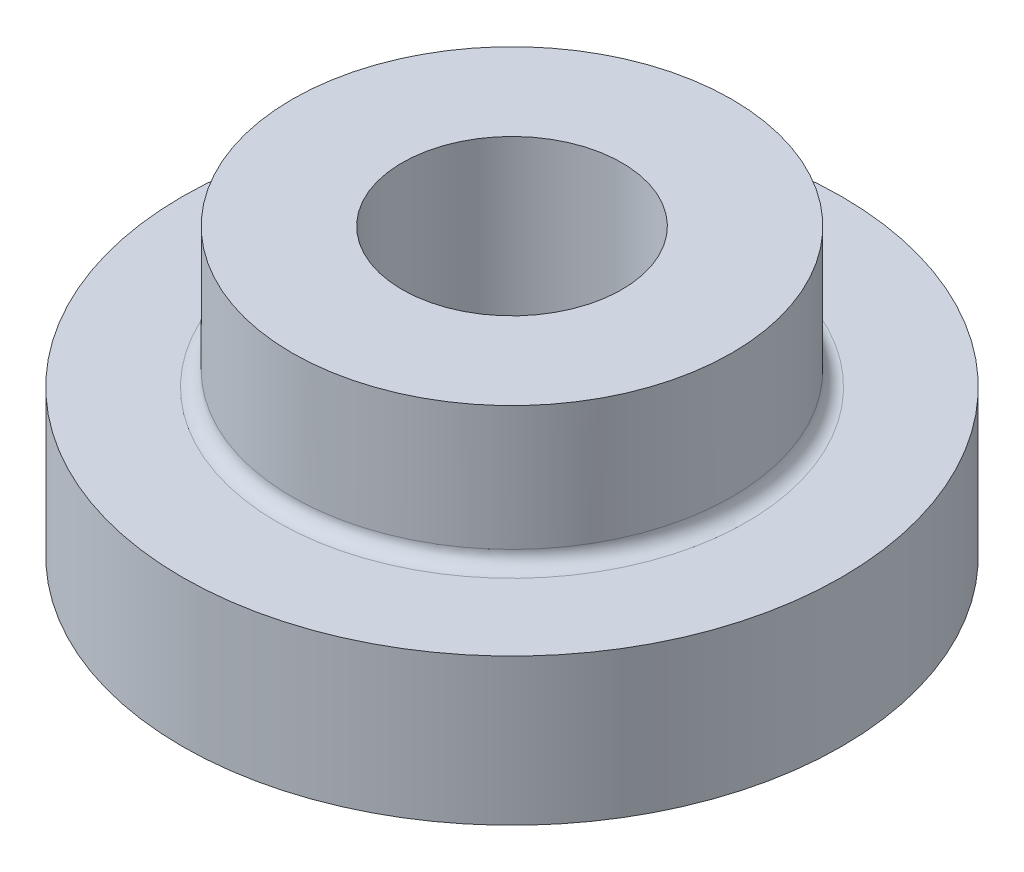
from build123d import *

# Parameters (mm, degrees)
SKETCH1_R                = 3
BOSS_EXTRUDE1_DEPTH      = 2.3
SHELL1_T                 = -1.5
BOSS_EXTRUDE2_DEPTH      = 1.6
BOSS_EXTRUDE2_DEPTH_BACK = 0.4
SKETCH2_R                = 4.5
SKETCH2_R_2              = 3
FILLET4_R                = 0.2


with BuildPart() as part:
    # Sketch1 → Boss-Extrude1 (new body)
    with BuildSketch(Plane(origin=(0, 0, 0), x_dir=(1, 0, 0), z_dir=(0, 1, 0))):
        with Locations(Location((0, 0, 0), (0, 0, 270))):
            Circle(SKETCH1_R)
    extrude(amount=BOSS_EXTRUDE1_DEPTH)

    # Shell1
    shell1_openings = [part.faces().sort_by_distance(p)[0] for p in [
        (0, 2.3, 0),
        (0, 0, 0),
    ]]
    offset(amount=SHELL1_T, openings=shell1_openings, kind=Kind.INTERSECTION)

    # Sketch2 → Boss-Extrude2 (add, two sides: drawn at the far end of the back side and taken through both)
    with BuildSketch(Plane.XZ.offset(-BOSS_EXTRUDE2_DEPTH_BACK)):
        with Locations(Location((0, 0, 0), (0, 0, 270))):
            Circle(SKETCH2_R)
        with Locations(Location((0, 0, 0), (0, 0, 270))):
            Circle(SKETCH2_R_2, mode=Mode.SUBTRACT)
    extrude(amount=BOSS_EXTRUDE2_DEPTH + BOSS_EXTRUDE2_DEPTH_BACK)

    # Fillet4
    fillet4_edges = [part.edges().sort_by_distance(p)[0] for p in [
        (0, 0.4, -3),
        (0, 0, 3),
    ]]
    fillet(fillet4_edges, radius=FILLET4_R)


solid = part.part
